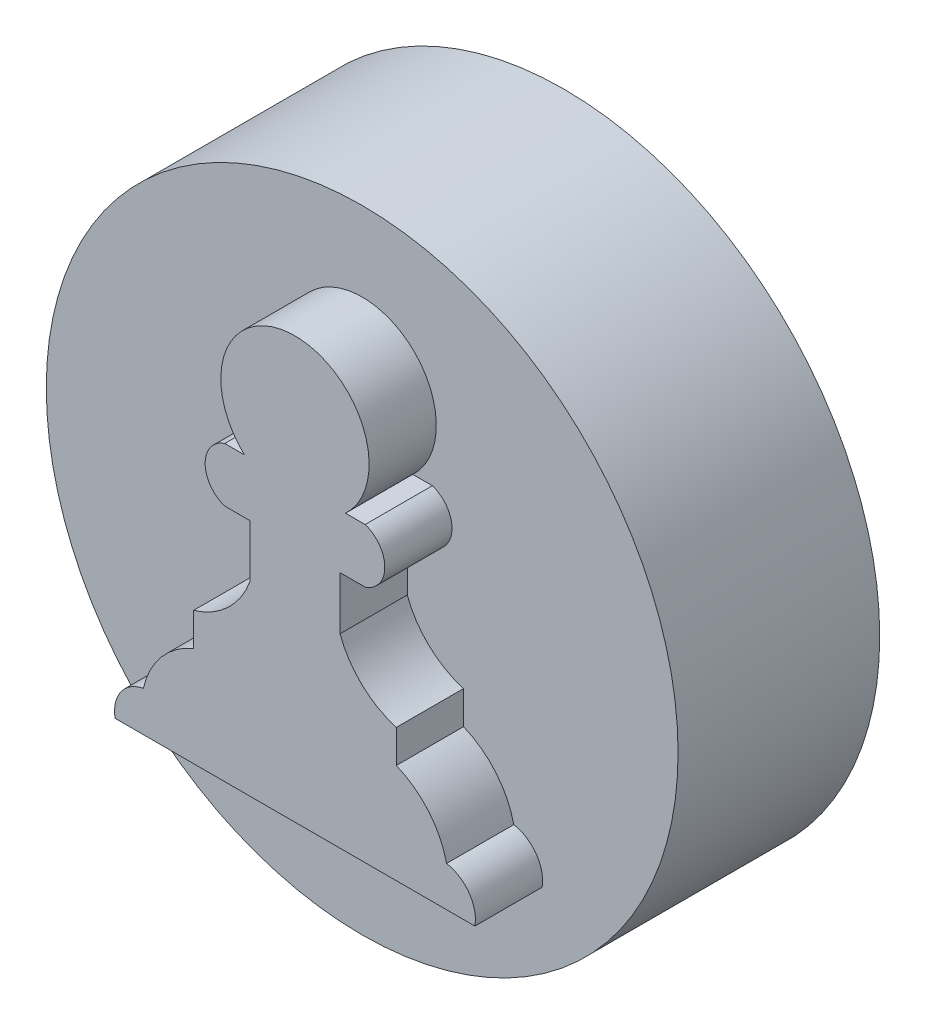
from build123d import *

# Parameters (mm, degrees)
SKETCH1_R           = 11.938
SKETCH1_R_2         = 8.763
BOSS_EXTRUDE1_DEPTH = 5.08
SKETCH2_R           = 11.938
BOSS_EXTRUDE2_DEPTH = 2.54
BOSS_EXTRUDE3_DEPTH = 2.54


with BuildPart() as part:
    # Sketch1 → Boss-Extrude1 (new body)
    with BuildSketch(Plane.XY):
        Circle(SKETCH1_R)
        Circle(SKETCH1_R_2, mode=Mode.SUBTRACT)
    extrude(amount=BOSS_EXTRUDE1_DEPTH)

    # Sketch2 → Boss-Extrude2 (add)
    with BuildSketch(Plane.XY.offset(5.08)):
        Circle(SKETCH2_R)
    extrude(amount=BOSS_EXTRUDE2_DEPTH)

    # Sketch3 → Boss-Extrude3 (add)
    with BuildSketch(Plane.XY.offset(7.62)):
        with BuildLine():
            Line((6.799209261, -6.976502995), (-6.799209261, -6.976502995))
            ThreePointArc((-6.799209261, -6.976502995), (-6.57773466, -5.997747251), (-5.729043644, -5.462268619))
            ThreePointArc((-5.729043644, -5.462268619), (-5.055714591, -4.101642026), (-3.830122247, -3.205762488))
            Line((-3.830122247, -3.205762488), (-3.830122247, -1.958745943))
            ThreePointArc((-3.830122247, -1.958745943), (-2.529170198, -1.211237743), (-1.703785584, 0.041752673))
            Line((-1.703785584, 0.041752673), (-1.703785584, 2.042251288))
            Line((-1.703785584, 2.042251288), (-2.652822308, 2.042251288))
            ThreePointArc((-2.652822308, 2.042251288), (-3.394876144, 3.066744886), (-2.652822308, 4.091238485))
            Line((-2.652822308, 4.091238485), (-1.910768473, 4.091238485))
            ThreePointArc((-1.910768473, 4.091238485), (0, 8.941901019), (1.910768473, 4.091238485))
            Line((1.910768473, 4.091238485), (2.652822308, 4.091238485))
            ThreePointArc((2.652822308, 4.091238485), (3.394876144, 3.066744886), (2.652822308, 2.042251288))
            Line((2.652822308, 2.042251288), (1.703785584, 2.042251288))
            Line((1.703785584, 2.042251288), (1.703785584, 0.041752673))
            ThreePointArc((1.703785584, 0.041752673), (2.529170198, -1.211237743), (3.830122247, -1.958745943))
            Line((3.830122247, -1.958745943), (3.830122247, -3.205762488))
            ThreePointArc((3.830122247, -3.205762488), (5.055714591, -4.101642026), (5.729043644, -5.462268619))
            ThreePointArc((5.729043644, -5.462268619), (6.57773466, -5.997747251), (6.799209261, -6.976502995))
        make_face()
    extrude(amount=BOSS_EXTRUDE3_DEPTH)


solid = part.part
